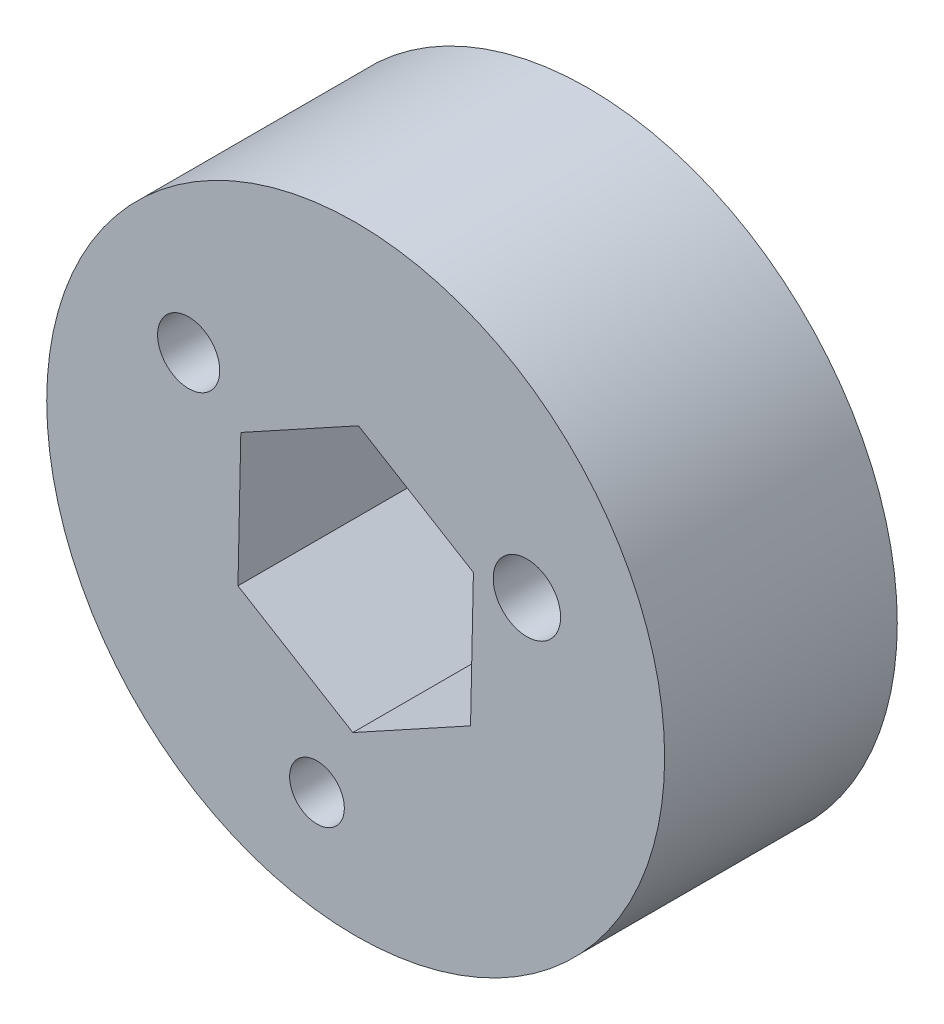
from build123d import *

# Parameters (mm, degrees)
SKETCH2_R           = 16.86788292
SKETCH2_R_2         = 1.697640298
SKETCH2_R_3         = 1.839394333
SKETCH2_R_4         = 1.494089935
BOSS_EXTRUDE1_DEPTH = 12.7


with BuildPart() as part:
    # Sketch2 → Boss-Extrude1 (new body)
    with BuildSketch(Plane.XY):
        Circle(SKETCH2_R)
        with Locations((-9.118891252, 6.145879466)):
            Circle(SKETCH2_R_2, mode=Mode.SUBTRACT)
        with Locations((9.347171253, 3.791989153)):
            Circle(SKETCH2_R_3, mode=Mode.SUBTRACT)
        with Locations((-2.113411396, -11.140283228)):
            Circle(SKETCH2_R_4, mode=Mode.SUBTRACT)
        Polygon((-6.270235486, 3.800984121), (0.156631065, 7.330675279), (6.426866551, 3.529691158), (6.270235486, -3.800984121), (-0.156631065, -7.330675279), (-6.426866551, -3.529691158), align=None, mode=Mode.SUBTRACT)
    extrude(amount=BOSS_EXTRUDE1_DEPTH)


solid = part.part
